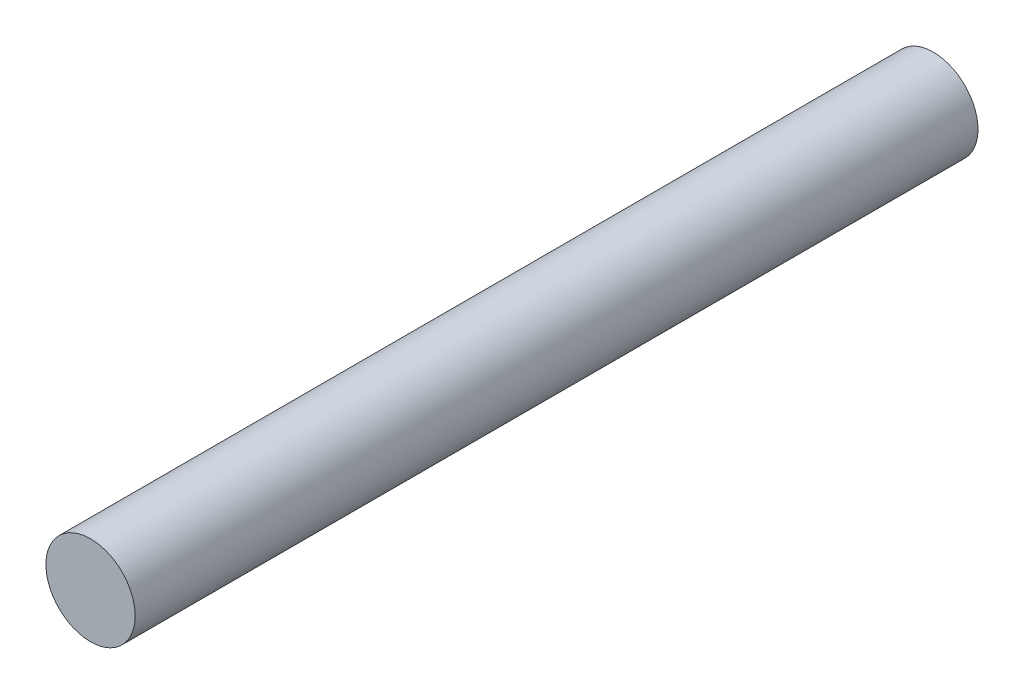
from build123d import *

# Parameters (mm, degrees)
SKETCH1_R           = 4.7625
BOSS_EXTRUDE1_DEPTH = 89.94775


with BuildPart() as part:
    # Sketch1 → Boss-Extrude1 (new body)
    with BuildSketch(Plane.XY):
        Circle(SKETCH1_R)
    extrude(amount=BOSS_EXTRUDE1_DEPTH)


solid = part.part
